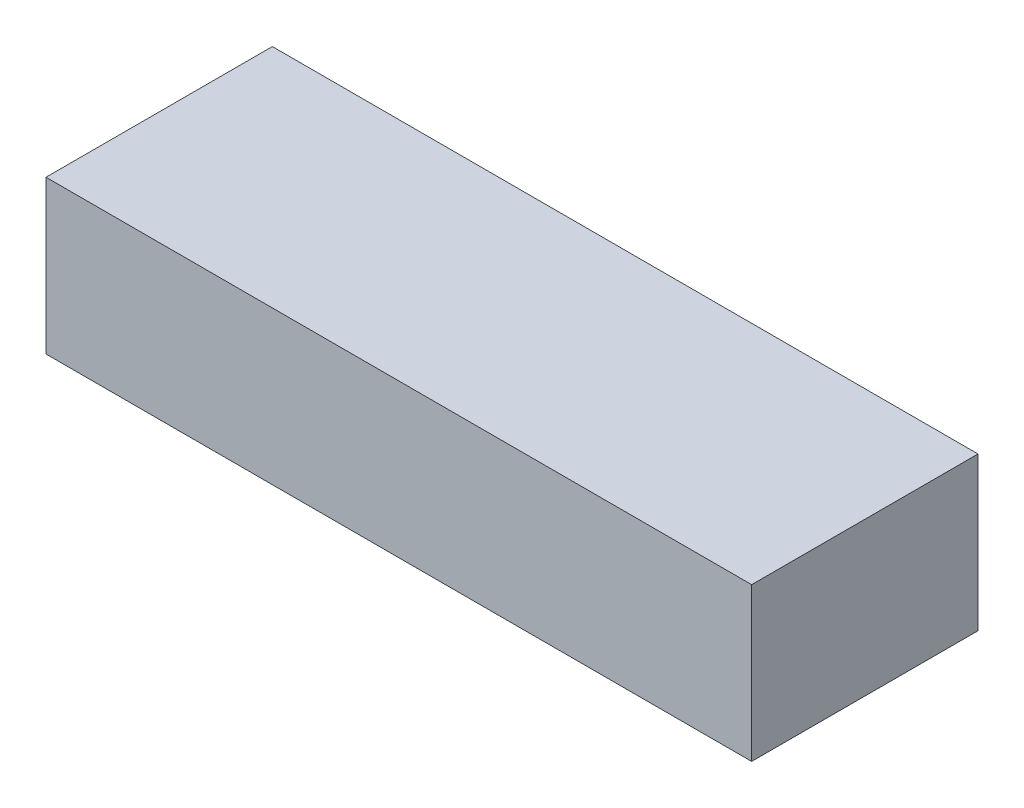
from build123d import *

# Parameters (mm, degrees)
SKETCH1_W           = 106
SKETCH1_H           = 34
BOSS_EXTRUDE1_DEPTH = 23


with BuildPart() as part:
    # Sketch1 → Boss-Extrude1 (new body)
    with BuildSketch(Plane(origin=(0, 0, 0), x_dir=(1, 0, 0), z_dir=(0, 1, 0))):
        Rectangle(SKETCH1_W, SKETCH1_H)
    extrude(amount=BOSS_EXTRUDE1_DEPTH)


solid = part.part
